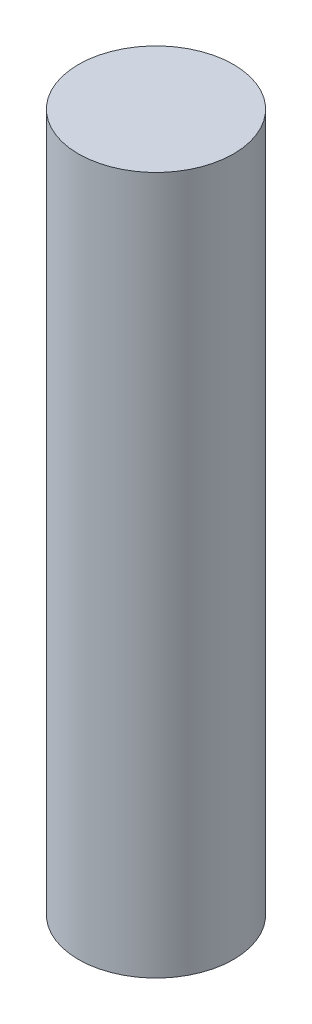
from build123d import *

# Parameters (mm, degrees)
SKETCH1_R           = 3
BOSS_EXTRUDE1_DEPTH = 27


with BuildPart() as part:
    # Sketch1 → Boss-Extrude1 (new body)
    with BuildSketch(Plane(origin=(0, 0, 0), x_dir=(1, 0, 0), z_dir=(0, 1, 0))):
        with Locations(Location((0, 0, 0), (0, 0, 270))):
            Circle(SKETCH1_R)
    extrude(amount=BOSS_EXTRUDE1_DEPTH)


solid = part.part
